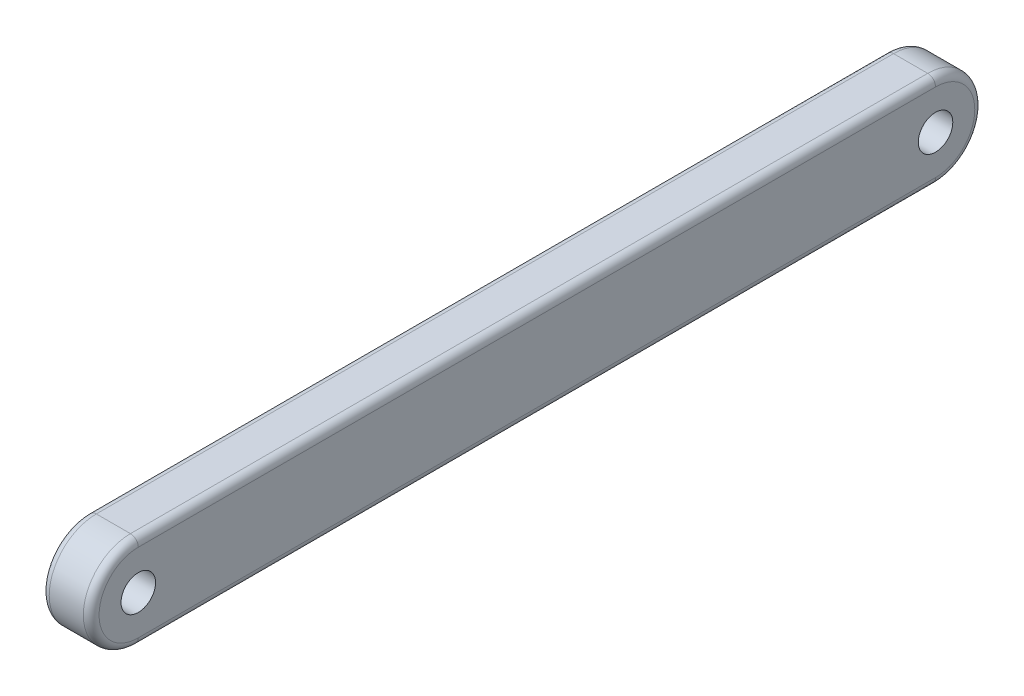
from build123d import *

# Parameters (mm, degrees)
SKETCH1_R           = 2.2
BOSS_EXTRUDE1_DEPTH = 6.35
FILLET1_R           = 1


with BuildPart() as part:
    # Sketch1 → Boss-Extrude1 (new body)
    with BuildSketch(Plane(origin=(0, 0, 0), x_dir=(0, 0, -1), z_dir=(1, 0, 0))):
        with BuildLine():
            Line((0, 6), (101.6, 6))
            ThreePointArc((101.6, 6), (107.6, 0), (101.6, -6))
            Line((101.6, -6), (0, -6))
            ThreePointArc((0, -6), (-6, 0), (0, 6))
        make_face()
        Circle(SKETCH1_R, mode=Mode.SUBTRACT)
        with Locations((101.6, 0)):
            Circle(SKETCH1_R, mode=Mode.SUBTRACT)
    extrude(amount=BOSS_EXTRUDE1_DEPTH)

    # Fillet1
    fillet1_edges = [part.edges().sort_by_distance(p)[0] for p in [
        (6.35, 0, -107.6),
        (6.35, 6, -50.8),
        (6.35, 0, 6),
        (0, 6, -50.8),
        (0, 0, -107.6),
        (0, -6, -50.8),
        (0, 0, 6),
        (6.35, -6, -50.8),
    ]]
    fillet(fillet1_edges, radius=FILLET1_R)


solid = part.part
